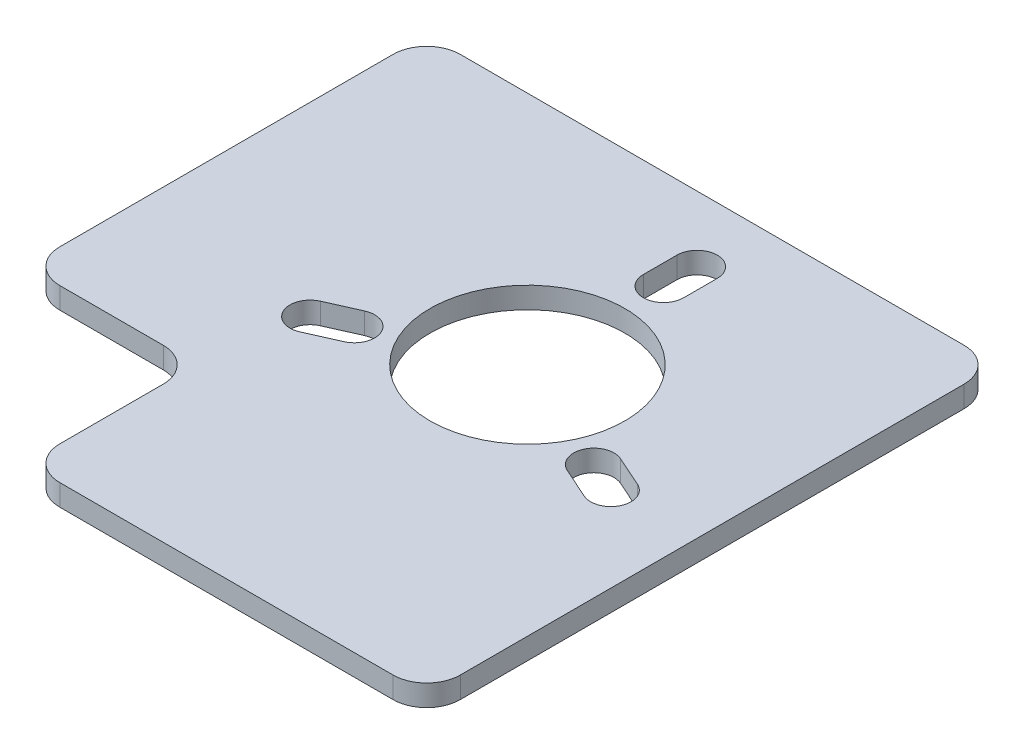
from build123d import *

# Parameters (mm, degrees)
SKETCH1_W           = 170
SKETCH1_H           = 170
SKETCH1_R           = 29
BOSS_EXTRUDE1_DEPTH = 6.35
SKETCH2_W           = 50.8
SKETCH2_H           = 50.8
CUT_EXTRUDE1_DEPTH  = 241.500150728
FILLET1_R           = 10
CUT_EXTRUDE2_DEPTH  = 241.500150728


with BuildPart() as part:
    # Sketch1 → Boss-Extrude1 (new body)
    with BuildSketch(Plane(origin=(0, 0, 0), x_dir=(1, 0, 0), z_dir=(0, 1, 0))):
        with Locations((85, 85)):
            Rectangle(SKETCH1_W, SKETCH1_H)
        with Locations(Location((100, 100, 0), (0, 0, 270))):
            Circle(SKETCH1_R, mode=Mode.SUBTRACT)
    extrude(amount=BOSS_EXTRUDE1_DEPTH)

    # Sketch2 → Cut-Extrude1 (cut, through all)
    with BuildSketch(Plane(origin=(0, 6.35, 0), x_dir=(1, 0, 0), z_dir=(0, 1, 0))):
        with Locations((25.4, 25.4)):
            Rectangle(SKETCH2_W, SKETCH2_H)
    extrude(amount=-CUT_EXTRUDE1_DEPTH, mode=Mode.SUBTRACT)

    # Fillet1
    fillet1_edges = [part.edges().sort_by_distance(p)[0] for p in [
        (0, 3.175, -50.8),
        (50.8, 3.175, -50.8),
        (50.8, 3.175, 0),
        (0, 3.175, -170),
        (170, 3.175, -170),
        (170, 3.175, 0),
    ]]
    fillet(fillet1_edges, radius=FILLET1_R)

    # Sketch3 → Cut-Extrude2 (cut, through all)
    with BuildSketch(Plane(origin=(0, 6.35, 0), x_dir=(1, 0, 0), z_dir=(0, 1, 0))):
        with BuildLine():
            Line((106, 150.5), (106, 140.5))
            ThreePointArc((106, 140.5), (100, 134.5), (94, 140.5))
            Line((94, 140.5), (94, 150.5))
            ThreePointArc((94, 150.5), (100, 156.5), (106, 150.5))
        make_face()
        with BuildLine():
            Line((52.795852717, 85.551177235), (61.931307293, 89.618543666))
            ThreePointArc((61.931307293, 89.618543666), (69.852999898, 86.577690778), (66.81214701, 78.655998174))
            Line((66.81214701, 78.655998174), (57.676692434, 74.588631743))
            ThreePointArc((57.676692434, 74.588631743), (49.75499983, 77.629484631), (52.795852717, 85.551177235))
        make_face()
        with BuildLine():
            Line((142.323307566, 74.588631743), (133.18785299, 78.655998174))
            ThreePointArc((133.18785299, 78.655998174), (130.147000102, 86.577690778), (138.068692707, 89.618543666))
            Line((138.068692707, 89.618543666), (147.204147283, 85.551177235))
            ThreePointArc((147.204147283, 85.551177235), (150.24500017, 77.629484631), (142.323307566, 74.588631743))
        make_face()
    extrude(amount=-CUT_EXTRUDE2_DEPTH, mode=Mode.SUBTRACT)


solid = part.part
